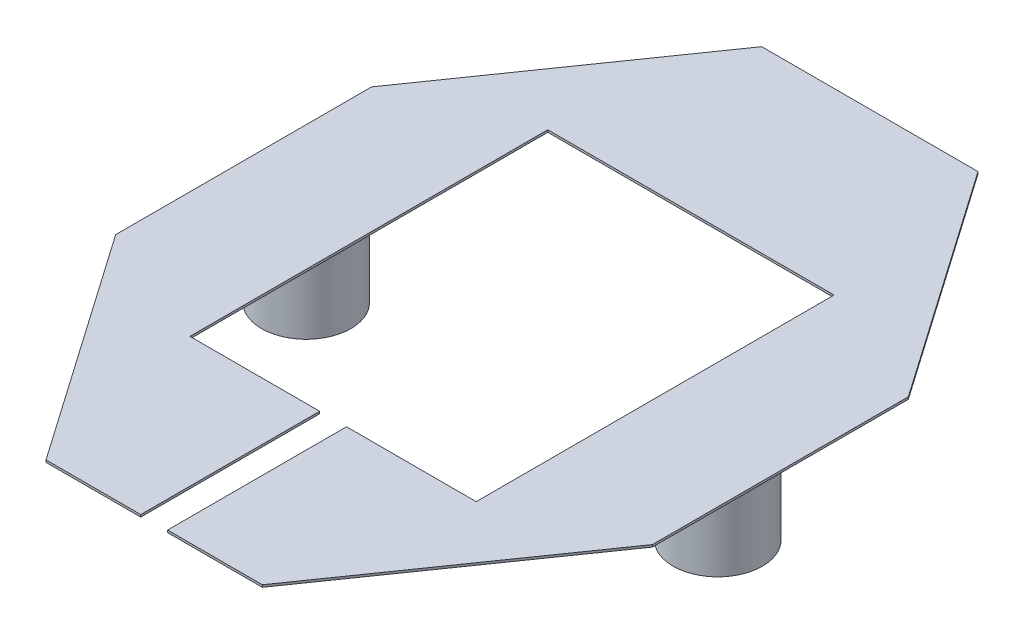
from build123d import *

# Parameters (mm, degrees)
SKETCH1_W           = 33
SKETCH1_H           = 43
BOSS_EXTRUDE1_DEPTH = 0.375
CUT_EXTRUDE1_DEPTH  = 0.25
SKETCH3_W           = 16
SKETCH3_H           = 20
CUT_EXTRUDE2_DEPTH  = 4.125
CUT_EXTRUDE3_DEPTH  = 4.125
SKETCH5_W           = 1.5
SKETCH5_H           = 10
CUT_EXTRUDE4_DEPTH  = 10
SKETCH6_W           = 11.671124307
SKETCH6_H           = 24.955330834
SKETCH6_W_2         = 23.228162705
SKETCH6_H_2         = 5.306808708
SKETCH6_W_3         = 8.676096845
SKETCH6_H_3         = 22.396436041
SKETCH6_W_4         = 27.721988928
SKETCH6_H_4         = 5.80460418
CUT_EXTRUDE5_DEPTH  = 5
SKETCH7_R           = 2.5
SKETCH7_R_2         = 1.5
BOSS_EXTRUDE2_DEPTH = 5


with BuildPart() as part:
    # Sketch1 → Boss-Extrude1 (new body)
    with BuildSketch(Plane(origin=(0, 0, 0), x_dir=(1, 0, 0), z_dir=(0, 1, 0))):
        Rectangle(SKETCH1_W, SKETCH1_H)
    extrude(amount=BOSS_EXTRUDE1_DEPTH)

    # Sketch2 → Cut-Extrude1 (cut)
    with BuildSketch(Plane.XZ):
        Polygon((5, 21.5), (16.5, 21.5), (16.5, 5), (15, 5), (15, -5), (16.5, -5), (16.5, -21.5), (5, -21.5), (5, -20), (-5, -20), (-5, -21.5), (-16.5, -21.5), (-16.5, -5), (-15, -5), (-15, 5), (-16.5, 5), (-16.5, 21.5), (-5, 21.5), (-5, 20), (5, 20), align=None)
    extrude(amount=-CUT_EXTRUDE1_DEPTH, mode=Mode.SUBTRACT)

    # Sketch3 → Cut-Extrude2 (cut)
    with BuildSketch(Plane.XZ.offset(-0.25)):
        Rectangle(SKETCH3_W, SKETCH3_H)
    extrude(amount=-CUT_EXTRUDE2_DEPTH, mode=Mode.SUBTRACT)

    # Sketch4 → Cut-Extrude3 (cut)
    with BuildSketch(Plane.XZ.offset(-0.25)):
        Polygon((-5, 21.5), (-16.5, 5), (-16.5, 21.5), align=None)
        Polygon((5, 21.5), (16.5, 5), (16.5, 21.5), align=None)
        Polygon((-16.5, -5), (-5, -21.5), (-16.5, -21.5), align=None)
        Polygon((16.5, -5), (5, -21.5), (16.5, -21.5), align=None)
    extrude(amount=-CUT_EXTRUDE3_DEPTH, mode=Mode.SUBTRACT)

    # Sketch5 → Cut-Extrude4 (cut)
    with BuildSketch(Plane.XZ.offset(-0.25)):
        with Locations((0, 15)):
            Rectangle(SKETCH5_W, SKETCH5_H)
    extrude(amount=-CUT_EXTRUDE4_DEPTH, mode=Mode.SUBTRACT)

    # Sketch6 → Cut-Extrude5 (cut, symmetric)
    with BuildSketch(Plane.XZ.offset(-0.25)):
        with Locations((20.835562154, -1.334081217)):
            Rectangle(SKETCH6_W, SKETCH6_H)
        with Locations((-0.739473345, -22.653404354)):
            Rectangle(SKETCH6_W_2, SKETCH6_H_2)
        with Locations((-19.338048423, -1.063266803)):
            Rectangle(SKETCH6_W_3, SKETCH6_H_3)
        with Locations((-0.937806624, 22.90230209)):
            Rectangle(SKETCH6_W_4, SKETCH6_H_4)
    extrude(amount=CUT_EXTRUDE5_DEPTH, both=True, mode=Mode.SUBTRACT)

    # Sketch7 → Boss-Extrude2 (add)
    # profile 1 of 2: a face of its own
    with BuildSketch(Plane(origin=(0, 0.25, 0), x_dir=(-1, 0, 0), z_dir=(0, -1, 0))):
        with Locations(Location((11.5, 0, 0), (0, 0, 270))):
            Circle(SKETCH7_R)
        with Locations(Location((11.5, 0, 0), (0, 0, 90))):
            Circle(SKETCH7_R_2, mode=Mode.SUBTRACT)
    # profile 2 of 2: a face of its own
    with BuildSketch(Plane(origin=(0, 0.25, 0), x_dir=(-1, 0, 0), z_dir=(0, -1, 0))):
        with Locations(Location((-11.5, 0, 0), (0, 0, 270))):
            Circle(SKETCH7_R)
        with Locations(Location((-11.5, 0, 0), (0, 0, 90))):
            Circle(SKETCH7_R_2, mode=Mode.SUBTRACT)
    extrude(amount=BOSS_EXTRUDE2_DEPTH)


solid = part.part
